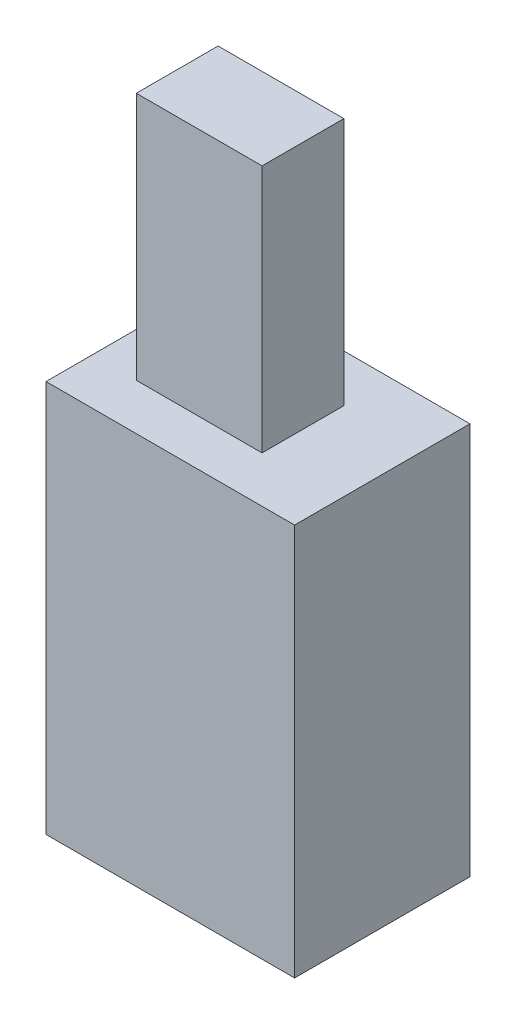
from build123d import *

# Parameters (mm, degrees)
SKETCH2_W           = 28.223194522
SKETCH2_H           = 63.118302446
BOSS_EXTRUDE1_DEPTH = 40
SKETCH3_W           = 20.240399561
SKETCH3_H           = 13.165486444
BOSS_EXTRUDE2_DEPTH = 40
SKETCH4_W           = 1.771293225
SKETCH4_H           = 17.429024706
BOSS_EXTRUDE3_DEPTH = 5


with BuildPart() as part:
    # Sketch2 → Boss-Extrude1 (new body)
    with BuildSketch(Plane(origin=(0, 0, 0), x_dir=(0, 0, -1), z_dir=(1, 0, 0))):
        with Locations((-8.942937098, -17.623594379)):
            Rectangle(SKETCH2_W, SKETCH2_H)
    extrude(amount=BOSS_EXTRUDE1_DEPTH)

    # Sketch3 → Boss-Extrude2 (add)
    with BuildSketch(Plane(origin=(0, 13.935556844, 0), x_dir=(1, 0, 0), z_dir=(0, 1, 0))):
        with Locations((17.206915962, -9.033113003)):
            Rectangle(SKETCH3_W, SKETCH3_H)
    extrude(amount=BOSS_EXTRUDE2_DEPTH)

    # Sketch4 → Boss-Extrude3 (add)
    with BuildSketch(Plane(origin=(0, -49.182745602, 0), x_dir=(-1, 0, 0), z_dir=(0, -1, 0))):
        with Locations((-2.379477455, -5.206851056)):
            Rectangle(SKETCH4_W, SKETCH4_H)
    extrude(amount=BOSS_EXTRUDE3_DEPTH)


solid = part.part
